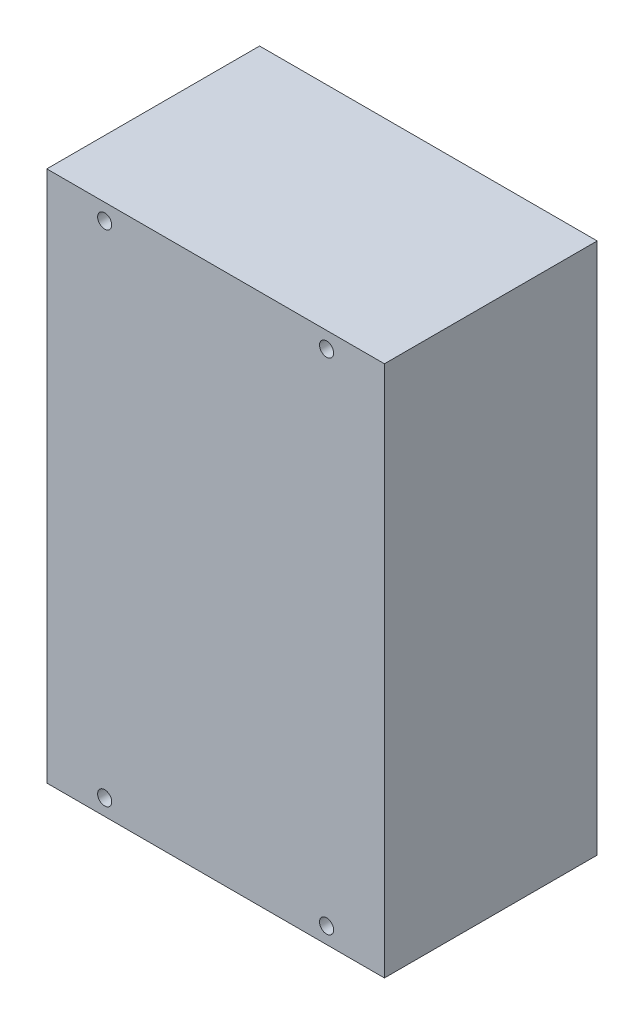
from build123d import *

# Parameters (mm, degrees)
SKETCH1_W           = 78.994
SKETCH1_H           = 124.46
SKETCH1_R           = 1.651
BOSS_EXTRUDE1_DEPTH = 49.784


with BuildPart() as part:
    # Sketch1 → Boss-Extrude1 (new body)
    with BuildSketch(Plane.XY):
        Rectangle(SKETCH1_W, SKETCH1_H)
        with Locations((-25.9588, 58.4454)):
            Circle(SKETCH1_R, mode=Mode.SUBTRACT)
        with Locations(Location((25.9588, 58.4454, 0), (0, 0, 180))):
            Circle(SKETCH1_R, mode=Mode.SUBTRACT)
        with Locations((25.9588, -58.4454)):
            Circle(SKETCH1_R, mode=Mode.SUBTRACT)
        with Locations(Location((-25.9588, -58.4454, 0), (0, 0, 180))):
            Circle(SKETCH1_R, mode=Mode.SUBTRACT)
    extrude(amount=BOSS_EXTRUDE1_DEPTH)


solid = part.part
